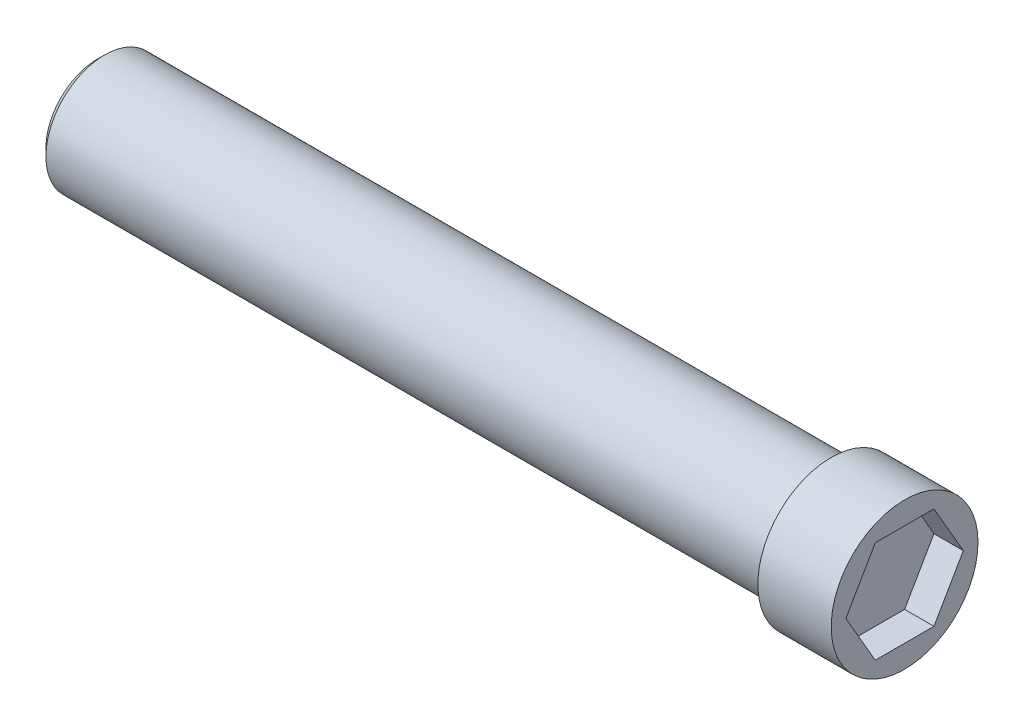
from build123d import *

# Parameters (mm, degrees)
CROQUIS1_R              = 4
SALIENTE_EXTRUIR1_DEPTH = 50
CROQUIS2_R              = 5
SALIENTE_EXTRUIR2_DEPTH = 5
CORTAR_EXTRUIR1_DEPTH   = 2
CHAFL_N1_SIZE           = 0.5


with BuildPart() as part:
    # Croquis1 → Saliente-Extruir1 (new body)
    with BuildSketch(Plane(origin=(0, 0, 0), x_dir=(0, 0, -1), z_dir=(1, 0, 0))):
        Circle(CROQUIS1_R)
    extrude(amount=SALIENTE_EXTRUIR1_DEPTH)

    # Croquis2 → Saliente-Extruir2 (add)
    with BuildSketch(Plane(origin=(50, 0, 0), x_dir=(0, 0, -1), z_dir=(1, 0, 0))):
        Circle(CROQUIS2_R)
    extrude(amount=SALIENTE_EXTRUIR2_DEPTH)

    # Croquis3 → Cortar-Extruir1 (cut)
    with BuildSketch(Plane(origin=(55, 0, 0), x_dir=(0, 0, -1), z_dir=(1, 0, 0))):
        Polygon((4, 0), (2, 3.464101615), (-2, 3.464101615), (-4, 0), (-2, -3.464101615), (2, -3.464101615), align=None)
    extrude(amount=-CORTAR_EXTRUIR1_DEPTH, mode=Mode.SUBTRACT)

    # Chaflán1
    chafl_n1_edges = [part.edges().sort_by_distance(p)[0] for p in [
        (0, 0, 4),
    ]]
    chamfer(chafl_n1_edges, length=CHAFL_N1_SIZE)


solid = part.part
